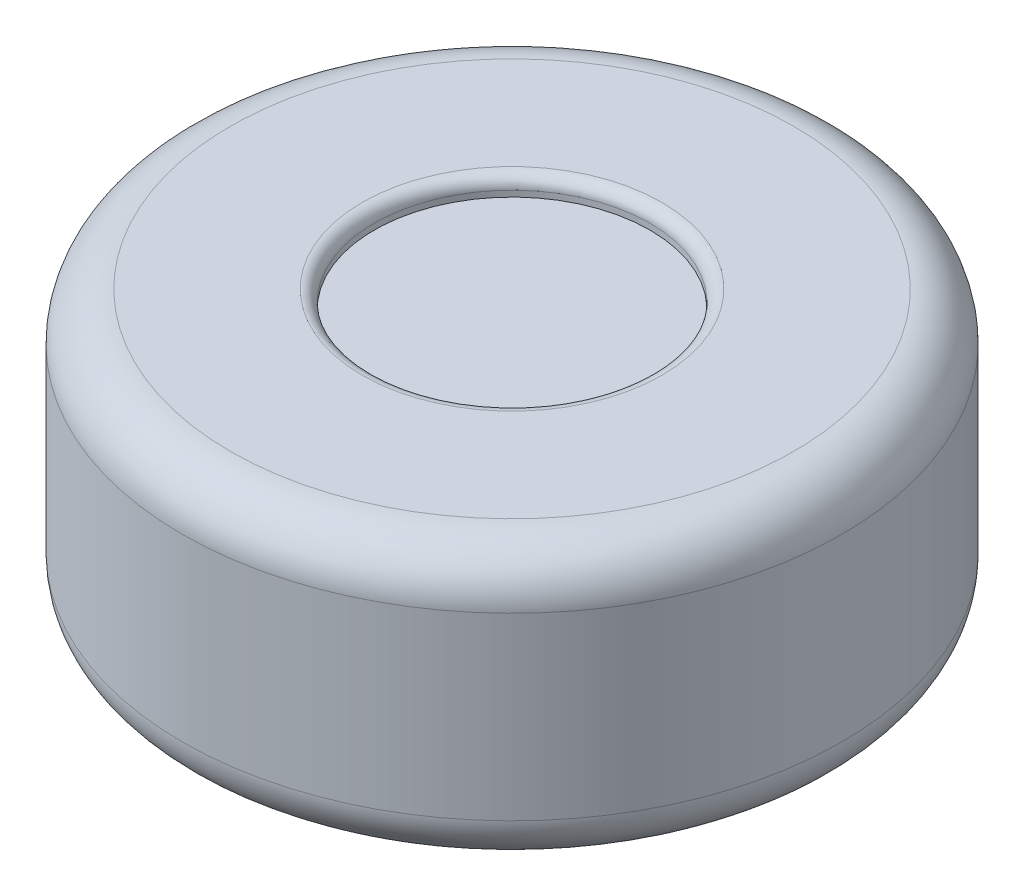
from build123d import *

# Parameters (mm, degrees)
SALIENTE_EXTRUIR1_DEPTH      = 100
SALIENTE_EXTRUIR1_DEPTH_BACK = 100
CROQUIS1_R                   = 120
SALIENTE_EXTRUIR4_DEPTH      = 115
SALIENTE_EXTRUIR4_DEPTH_BACK = 115
CROQUIS3_R                   = 275
CROQUIS3_R_2                 = 115
REDONDEO1_R                  = 40
REDONDEO2_R                  = 10
REDONDEO3_R                  = 10


with BuildPart() as part:
    # Croquis1 → Saliente-Extruir1 (new, two sides: drawn at the far end of the back side and taken through both)
    with BuildSketch(Plane(origin=(0, 0, 0), x_dir=(1, 0, 0), z_dir=(0, 1, 0)).offset(-SALIENTE_EXTRUIR1_DEPTH_BACK)):
        Circle(CROQUIS1_R)
    extrude(amount=SALIENTE_EXTRUIR1_DEPTH + SALIENTE_EXTRUIR1_DEPTH_BACK)

    # Croquis3 → Saliente-Extruir4 (add, two sides: drawn at the far end of the back side and taken through both)
    with BuildSketch(Plane(origin=(0, 0, 0), x_dir=(1, 0, 0), z_dir=(0, 1, 0)).offset(-SALIENTE_EXTRUIR4_DEPTH_BACK)):
        Circle(CROQUIS3_R)
        Circle(CROQUIS3_R_2, mode=Mode.SUBTRACT)
    extrude(amount=SALIENTE_EXTRUIR4_DEPTH + SALIENTE_EXTRUIR4_DEPTH_BACK)

    # Redondeo1
    redondeo1_edges = [part.edges().sort_by_distance(p)[0] for p in [
        (-275, 115, 0),
        (-275, -115, 0),
    ]]
    fillet(redondeo1_edges, radius=REDONDEO1_R)

    # Redondeo2
    redondeo2_edges = [part.edges().sort_by_distance(p)[0] for p in [
        (-115, -115, 0),
    ]]
    fillet(redondeo2_edges, radius=REDONDEO2_R)

    # Redondeo3
    redondeo3_edges = [part.edges().sort_by_distance(p)[0] for p in [
        (-115, 115, 0),
    ]]
    fillet(redondeo3_edges, radius=REDONDEO3_R)


solid = part.part
